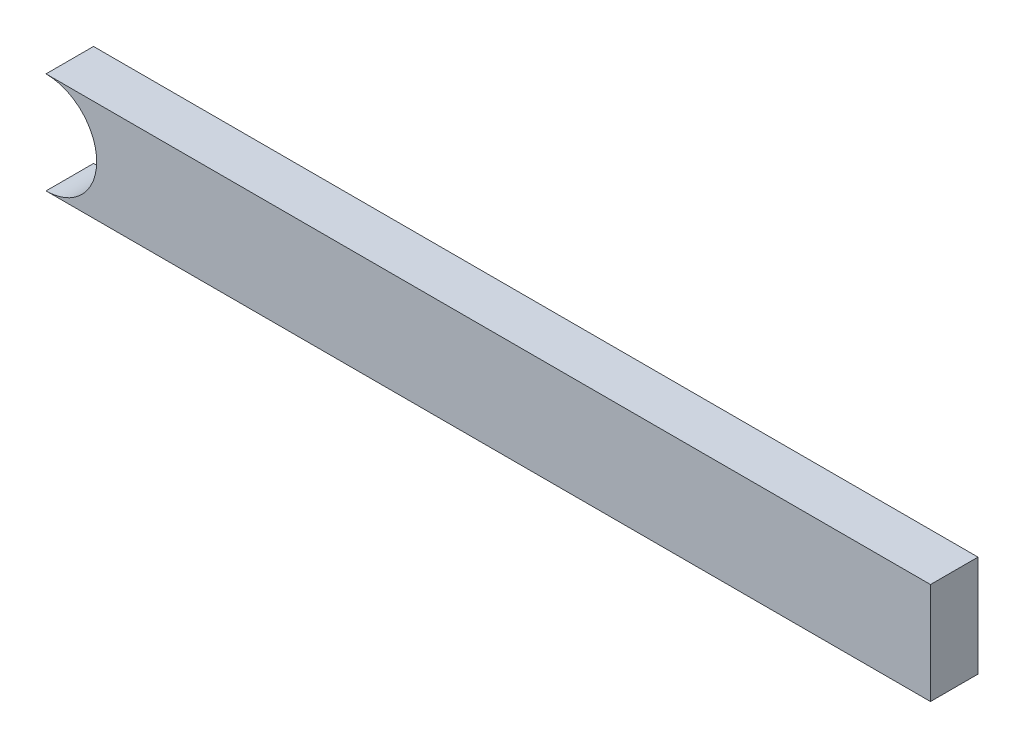
from build123d import *

# Parameters (mm, degrees)
BOSS_EXTRUDE1_DEPTH = 3


with BuildPart() as part:
    # Sketch1 → Boss-Extrude1 (new body)
    with BuildSketch(Plane.XY):
        with BuildLine():
            Line((27.923916792, -3.2), (-27.923916792, -3.2))
            ThreePointArc((-27.923916792, -3.2), (-24.723916792, 0), (-27.923916792, 3.2))
            Line((-27.923916792, 3.2), (27.923916792, 3.2))
            Line((27.923916792, 3.2), (27.923916792, -3.2))
        make_face()
    extrude(amount=BOSS_EXTRUDE1_DEPTH)


solid = part.part
